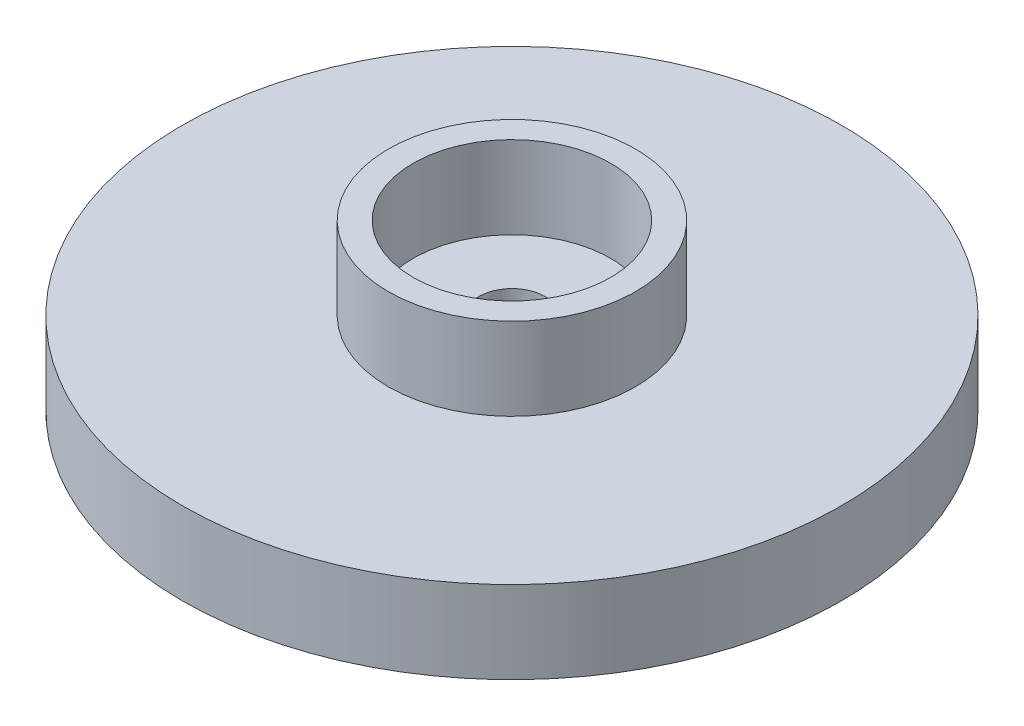
from build123d import *

# Parameters (mm, degrees)
SKETCH1_R           = 10
BOSS_EXTRUDE1_DEPTH = 2.5
SKETCH2_R           = 3.75
SKETCH2_R_2         = 3
BOSS_EXTRUDE2_DEPTH = 2.5
SKETCH4_R           = 1
CUT_EXTRUDE1_DEPTH  = 2.5


with BuildPart() as part:
    # Sketch1 → Boss-Extrude1 (new body)
    with BuildSketch(Plane(origin=(0, 0, 0), x_dir=(1, 0, 0), z_dir=(0, 1, 0))):
        with Locations(Location((0, 0, 0), (0, 0, 270))):
            Circle(SKETCH1_R)
    extrude(amount=BOSS_EXTRUDE1_DEPTH)

    # Sketch2 → Boss-Extrude2 (add)
    with BuildSketch(Plane(origin=(0, 2.5, 0), x_dir=(1, 0, 0), z_dir=(0, 1, 0))):
        with Locations(Location((0, 0, 0), (0, 0, 270))):
            Circle(SKETCH2_R)
        with Locations(Location((0, 0, 0), (0, 0, 270))):
            Circle(SKETCH2_R_2, mode=Mode.SUBTRACT)
    extrude(amount=BOSS_EXTRUDE2_DEPTH)

    # Sketch4 → Cut-Extrude1 (cut)
    with BuildSketch(Plane(origin=(0, 2.5, 0), x_dir=(1, 0, 0), z_dir=(0, 1, 0))):
        with Locations(Location((0, 0, 0), (0, 0, 270))):
            Circle(SKETCH4_R)
    extrude(amount=-CUT_EXTRUDE1_DEPTH, mode=Mode.SUBTRACT)


solid = part.part
